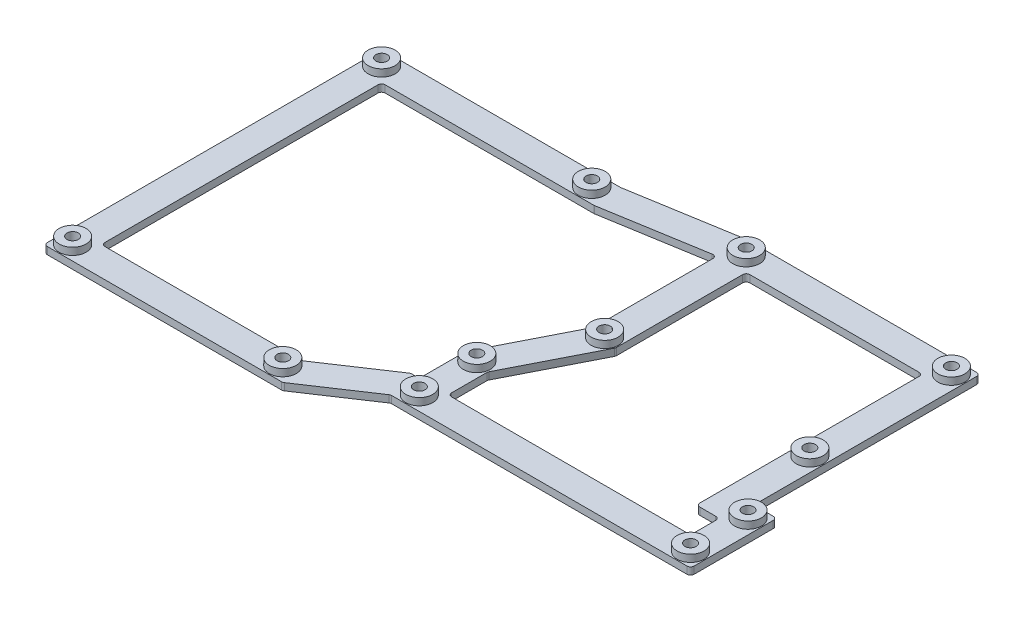
from build123d import *

# Parameters (mm, degrees)
SKETCH1_R           = 1.58
BOSS_EXTRUDE1_DEPTH = 2
SKETCH2_R           = 3.75
SKETCH2_R_2         = 1.58
BOSS_EXTRUDE2_DEPTH = 2
CUT_EXTRUDE5_DEPTH  = 99.635693337
FILLET4_R           = 1


with BuildPart() as part:
    # Sketch1 → Boss-Extrude1 (new body)
    with BuildSketch(Plane(origin=(0, 0, 0), x_dir=(1, 0, 0), z_dir=(0, 1, 0))):
        Polygon((76.6, -14), (83, -14), (83, -38), (-0.5, -38), (-18.5, -50), (-85, -50), (-85, 44), (-18.5, 44), (11.5, 49), (76.6, 49), align=None)
        with Locations(Location((15.5, 45, 0), (0, 0, 270))):
            Circle(SKETCH1_R, mode=Mode.SUBTRACT)
        with Locations(Location((72.6, 45, 0), (0, 0, 270))):
            Circle(SKETCH1_R, mode=Mode.SUBTRACT)
        with Locations(Location((72.6, 5.6, 0), (0, 0, 270))):
            Circle(SKETCH1_R, mode=Mode.SUBTRACT)
        with Locations(Location((15.5, 5.6, 0), (0, 0, 270))):
            Circle(SKETCH1_R, mode=Mode.SUBTRACT)
        with Locations(Location((-81, 40, 0), (0, 0, 270))):
            Circle(SKETCH1_R, mode=Mode.SUBTRACT)
        with Locations(Location((-22.5, 40, 0), (0, 0, 270))):
            Circle(SKETCH1_R, mode=Mode.SUBTRACT)
        with Locations(Location((-22.5, -46, 0), (0, 0, 270))):
            Circle(SKETCH1_R, mode=Mode.SUBTRACT)
        with Locations(Location((-81, -46, 0), (0, 0, 270))):
            Circle(SKETCH1_R, mode=Mode.SUBTRACT)
        with Locations(Location((79, -34, 0), (0, 0, 270))):
            Circle(SKETCH1_R, mode=Mode.SUBTRACT)
        with Locations(Location((79, -18, 0), (0, 0, 270))):
            Circle(SKETCH1_R, mode=Mode.SUBTRACT)
        with Locations(Location((3.5, -34, 0), (0, 0, 270))):
            Circle(SKETCH1_R, mode=Mode.SUBTRACT)
        with Locations(Location((3.5, -18, 0), (0, 0, 270))):
            Circle(SKETCH1_R, mode=Mode.SUBTRACT)
    extrude(amount=BOSS_EXTRUDE1_DEPTH)

    # Sketch2 → Boss-Extrude2 (add)
    # profile 1 of 12: a face of its own
    with BuildSketch(Plane(origin=(0, 2, 0), x_dir=(1, 0, 0), z_dir=(0, 1, 0))):
        with Locations(Location((-81, 40, 0), (0, 0, 90))):
            Circle(SKETCH2_R)
        with Locations(Location((-81, 40, 0), (0, 0, 270))):
            Circle(SKETCH2_R_2, mode=Mode.SUBTRACT)
    # profile 2 of 12: a face of its own
    with BuildSketch(Plane(origin=(0, 2, 0), x_dir=(1, 0, 0), z_dir=(0, 1, 0))):
        with Locations(Location((-22.5, 40, 0), (0, 0, 90))):
            Circle(SKETCH2_R)
        with Locations(Location((-22.5, 40, 0), (0, 0, 270))):
            Circle(SKETCH2_R_2, mode=Mode.SUBTRACT)
    # profile 3 of 12: a face of its own
    with BuildSketch(Plane(origin=(0, 2, 0), x_dir=(1, 0, 0), z_dir=(0, 1, 0))):
        with Locations(Location((-81, -46, 0), (0, 0, 90))):
            Circle(SKETCH2_R)
        with Locations(Location((-81, -46, 0), (0, 0, 270))):
            Circle(SKETCH2_R_2, mode=Mode.SUBTRACT)
    # profile 4 of 12: a face of its own
    with BuildSketch(Plane(origin=(0, 2, 0), x_dir=(1, 0, 0), z_dir=(0, 1, 0))):
        with Locations(Location((-22.5, -46, 0), (0, 0, 90))):
            Circle(SKETCH2_R)
        with Locations(Location((-22.5, -46, 0), (0, 0, 270))):
            Circle(SKETCH2_R_2, mode=Mode.SUBTRACT)
    # profile 5 of 12: a face of its own
    with BuildSketch(Plane(origin=(0, 2, 0), x_dir=(1, 0, 0), z_dir=(0, 1, 0))):
        with Locations(Location((3.5, -34, 0), (0, 0, 90))):
            Circle(SKETCH2_R)
        with Locations(Location((3.5, -34, 0), (0, 0, 270))):
            Circle(SKETCH2_R_2, mode=Mode.SUBTRACT)
    # profile 6 of 12: a face of its own
    with BuildSketch(Plane(origin=(0, 2, 0), x_dir=(1, 0, 0), z_dir=(0, 1, 0))):
        with Locations(Location((3.5, -18, 0), (0, 0, 90))):
            Circle(SKETCH2_R)
        with Locations(Location((3.5, -18, 0), (0, 0, 270))):
            Circle(SKETCH2_R_2, mode=Mode.SUBTRACT)
    # profile 7 of 12: a face of its own
    with BuildSketch(Plane(origin=(0, 2, 0), x_dir=(1, 0, 0), z_dir=(0, 1, 0))):
        with Locations(Location((15.5, 5.6, 0), (0, 0, 90))):
            Circle(SKETCH2_R)
        with Locations(Location((15.5, 5.6, 0), (0, 0, 270))):
            Circle(SKETCH2_R_2, mode=Mode.SUBTRACT)
    # profile 8 of 12: a face of its own
    with BuildSketch(Plane(origin=(0, 2, 0), x_dir=(1, 0, 0), z_dir=(0, 1, 0))):
        with Locations(Location((72.6, 5.6, 0), (0, 0, 90))):
            Circle(SKETCH2_R)
        with Locations(Location((72.6, 5.6, 0), (0, 0, 270))):
            Circle(SKETCH2_R_2, mode=Mode.SUBTRACT)
    # profile 9 of 12: a face of its own
    with BuildSketch(Plane(origin=(0, 2, 0), x_dir=(1, 0, 0), z_dir=(0, 1, 0))):
        with Locations(Location((79, -18, 0), (0, 0, 90))):
            Circle(SKETCH2_R)
        with Locations(Location((79, -18, 0), (0, 0, 270))):
            Circle(SKETCH2_R_2, mode=Mode.SUBTRACT)
    # profile 10 of 12: a face of its own
    with BuildSketch(Plane(origin=(0, 2, 0), x_dir=(1, 0, 0), z_dir=(0, 1, 0))):
        with Locations(Location((79, -34, 0), (0, 0, 90))):
            Circle(SKETCH2_R)
        with Locations(Location((79, -34, 0), (0, 0, 270))):
            Circle(SKETCH2_R_2, mode=Mode.SUBTRACT)
    # profile 11 of 12: a face of its own
    with BuildSketch(Plane(origin=(0, 2, 0), x_dir=(1, 0, 0), z_dir=(0, 1, 0))):
        with Locations(Location((72.6, 45, 0), (0, 0, 90))):
            Circle(SKETCH2_R)
        with Locations(Location((72.6, 45, 0), (0, 0, 270))):
            Circle(SKETCH2_R_2, mode=Mode.SUBTRACT)
    # profile 12 of 12: a face of its own
    with BuildSketch(Plane(origin=(0, 2, 0), x_dir=(1, 0, 0), z_dir=(0, 1, 0))):
        with Locations(Location((15.5, 45, 0), (0, 0, 90))):
            Circle(SKETCH2_R)
        with Locations(Location((15.5, 45, 0), (0, 0, 270))):
            Circle(SKETCH2_R_2, mode=Mode.SUBTRACT)
    extrude(amount=BOSS_EXTRUDE2_DEPTH)

    # Sketch7 → Cut-Extrude5 (cut, through all)
    with BuildSketch(Plane(origin=(0, 2, 0), x_dir=(1, 0, 0), z_dir=(0, 1, 0))):
        Polygon((-0.5, -17.04145027), (11.5, 6.55854973), (11.5, 40.88964996), (-17.837899758, 36), (-77, 36), (-77, -42), (-20.922205102, -42), (-2.922205102, -30), (-0.5, -30), align=None)
        Polygon((19.5, 4.64145027), (19.5, 41), (68.6, 41), (68.6, -22), (75, -22), (75, -30), (7.5, -30), (7.5, -18.95854973), align=None)
    extrude(amount=-CUT_EXTRUDE5_DEPTH, mode=Mode.SUBTRACT)

    # Fillet4
    fillet4_edges = [part.edges().sort_by_distance(p)[0] for p in [
        (7.5, 1, 18.95854973),
        (19.5, 1, -4.64145027),
        (19.5, 1, -41),
        (68.6, 1, -41),
        (68.6, 1, 22),
        (75, 1, 22),
        (75, 1, 30),
        (7.5, 1, 30),
        (-18.5, 1, -44),
        (11.5, 1, -49),
        (76.6, 1, -49),
        (76.6, 1, 14),
        (83, 1, 14),
        (83, 1, 38),
        (-0.5, 1, 38),
        (-17.837899758, 1, -36),
        (11.5, 1, -40.88964996),
        (-18.5, 1, 50),
        (11.5, 1, -6.55854973),
        (-0.5, 1, 17.04145027),
        (-0.5, 1, 30),
        (-85, 1, 50),
        (-2.922205102, 1, 30),
        (-20.922205102, 1, 42),
        (-85, 1, -44),
        (-77, 1, 42),
        (-77, 1, -36),
    ]]
    fillet(fillet4_edges, radius=FILLET4_R)


solid = part.part
